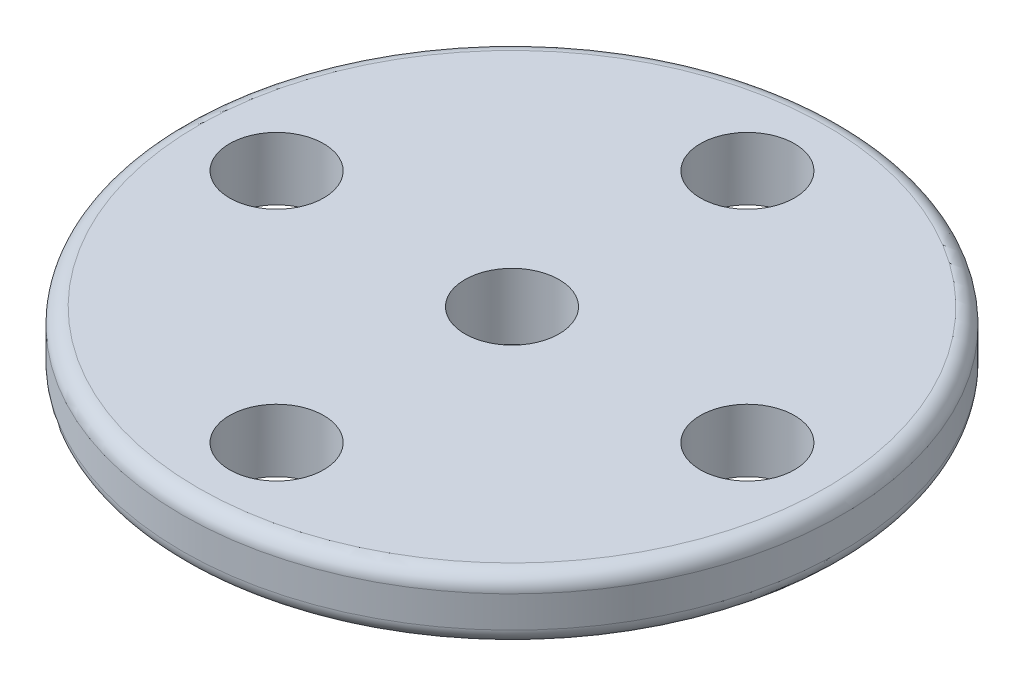
from build123d import *

# Parameters (mm, degrees)
FILLET1_R          = 0.5
SKETCH2_R          = 1.5
CUT_EXTRUDE1_DEPTH = 16.835087755


with BuildPart() as part:
    # Sketch1 → Revolve1 (revolve)
    with BuildSketch(Plane.XY, mode=Mode.PRIVATE) as revolve1_sk:
        Polygon((3, 0), (3, 3.4), (1.5, 3.4), (1.5, 5.5), (10.5, 5.5), (10.5, 3.5), (4.5, 3.5), (4.5, 0), align=None)
    revolve(revolve1_sk.sketch.rotate(Axis((0, 0, 0), (0, 1, 0)), 90), axis=Axis((0, 0, 0), (0, 1, 0)))

    # Fillet1
    fillet1_edges = [part.edges().sort_by_distance(p)[0] for p in [
        (0, 5.5, 10.5),
        (0, 3.5, 10.5),
        (0, 3.5, 4.5),
    ]]
    fillet(fillet1_edges, radius=FILLET1_R)

    # Sketch2 → Cut-Extrude1 (cut, through all)
    with BuildSketch(Plane(origin=(0, 5.5, 0), x_dir=(1, 0, 0), z_dir=(0, 1, 0))):
        with Locations(Location((0, 7.5, 0), (0, 0, 270))):
            Circle(SKETCH2_R)
        with Locations(Location((-7.5, 0, 0), (0, 0, 270))):
            Circle(SKETCH2_R)
        with Locations(Location((0, -7.5, 0), (0, 0, 270))):
            Circle(SKETCH2_R)
        with Locations(Location((7.5, 0, 0), (0, 0, 270))):
            Circle(SKETCH2_R)
    extrude(amount=-CUT_EXTRUDE1_DEPTH, mode=Mode.SUBTRACT)


solid = part.part
